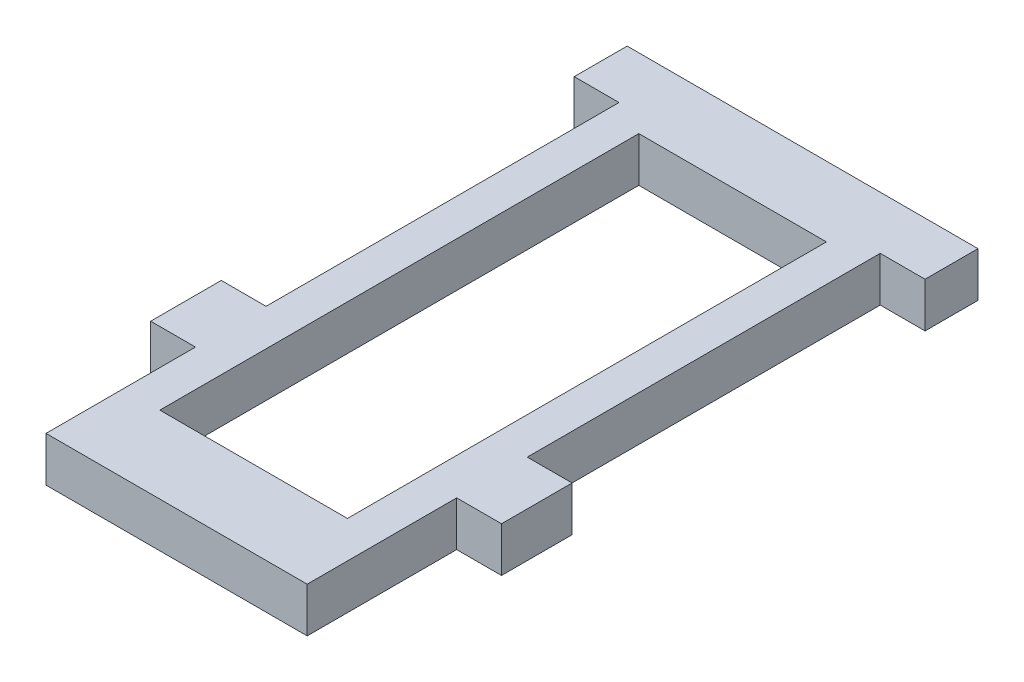
from build123d import *

# Parameters (mm, degrees)
SKETCH1_W           = 53.15
SKETCH1_H           = 135.7
BOSS_EXTRUDE1_DEPTH = 6.35


with BuildPart() as part:
    # Sketch1 → Boss-Extrude1 (new, symmetric)
    with BuildSketch(Plane(origin=(0, 0, 0), x_dir=(1, 0, 0), z_dir=(0, 1, 0))):
        Polygon((-37, -88.675), (-37, -46.325), (-49.7, -46.325), (-49.7, -26.325), (-37, -26.325), (-37, 73.675), (-49.7, 73.675), (-49.7, 88.675), (49.7, 88.675), (49.7, 73.675), (37, 73.675), (37, -26.325), (49.7, -26.325), (49.7, -46.325), (37, -46.325), (37, -88.675), align=None)
        with Locations((0, 1)):
            Rectangle(SKETCH1_W, SKETCH1_H, mode=Mode.SUBTRACT)
    extrude(amount=BOSS_EXTRUDE1_DEPTH, both=True)


solid = part.part
